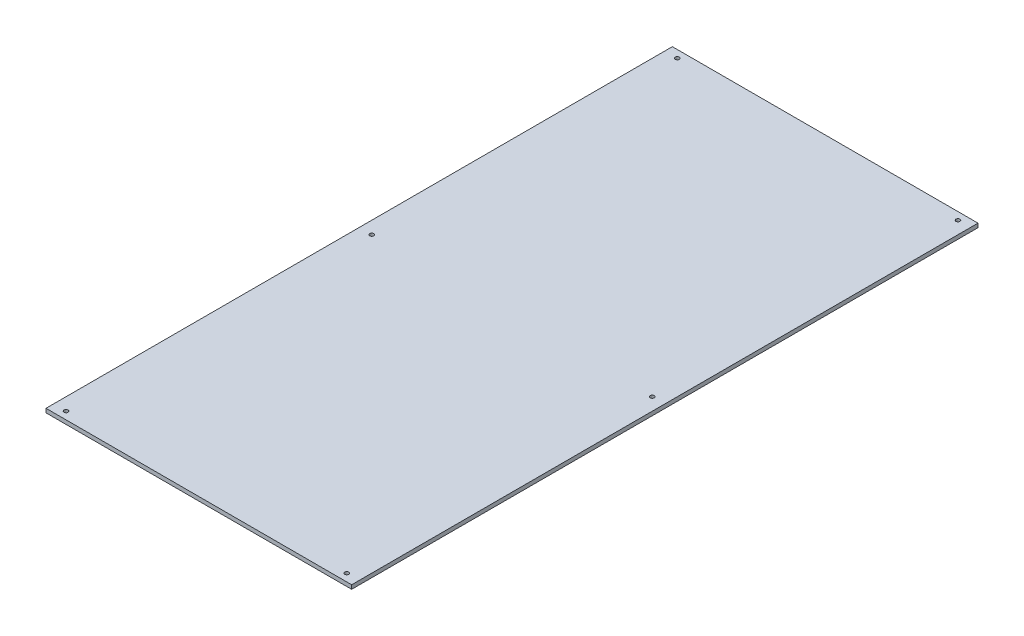
from build123d import *

# Parameters (mm, degrees)
SKETCH1_W           = 244
SKETCH1_H           = 500
SKETCH1_R           = 1.6
BOSS_EXTRUDE1_DEPTH = 3.175


with BuildPart() as part:
    # Sketch1 → Boss-Extrude1 (new body)
    with BuildSketch(Plane(origin=(0, 0, 0), x_dir=(1, 0, 0), z_dir=(0, 1, 0))):
        Rectangle(SKETCH1_W, SKETCH1_H)
        with Locations(Location((112, 244, 0), (0, 0, 270))):
            Circle(SKETCH1_R, mode=Mode.SUBTRACT)
        with Locations(Location((112, 0, 0), (0, 0, 270))):
            Circle(SKETCH1_R, mode=Mode.SUBTRACT)
        with Locations(Location((112, -244, 0), (0, 0, 90))):
            Circle(SKETCH1_R, mode=Mode.SUBTRACT)
        with Locations(Location((-112, -244, 0), (0, 0, 270))):
            Circle(SKETCH1_R, mode=Mode.SUBTRACT)
        with Locations(Location((-112, 0, 0), (0, 0, 90))):
            Circle(SKETCH1_R, mode=Mode.SUBTRACT)
        with Locations(Location((-112, 244, 0), (0, 0, 90))):
            Circle(SKETCH1_R, mode=Mode.SUBTRACT)
    extrude(amount=BOSS_EXTRUDE1_DEPTH)


solid = part.part
